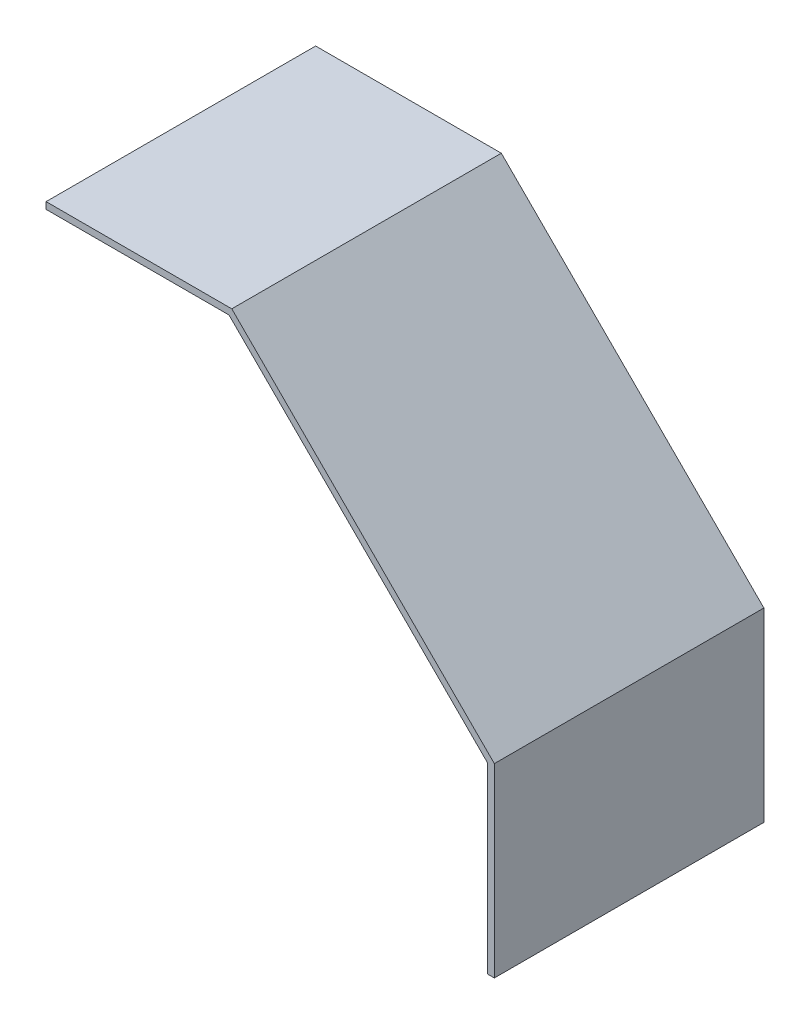
from build123d import *

# Parameters (mm, degrees)
EXTRUDE_THIN1_DEPTH = 254


with BuildPart() as part:
    # Sketch1 → Extrude-Thin1 (new body)
    with BuildSketch(Plane.XY):
        Polygon((0, 422.397722264), (174.962865277, 422.397722264), (422.397722264, 174.962865277), (422.397722264, 0), (416.047722264, 0), (416.047722264, 172.332609156), (172.332609156, 416.047722264), (0, 416.047722264), align=None)
    extrude(amount=EXTRUDE_THIN1_DEPTH)


solid = part.part
